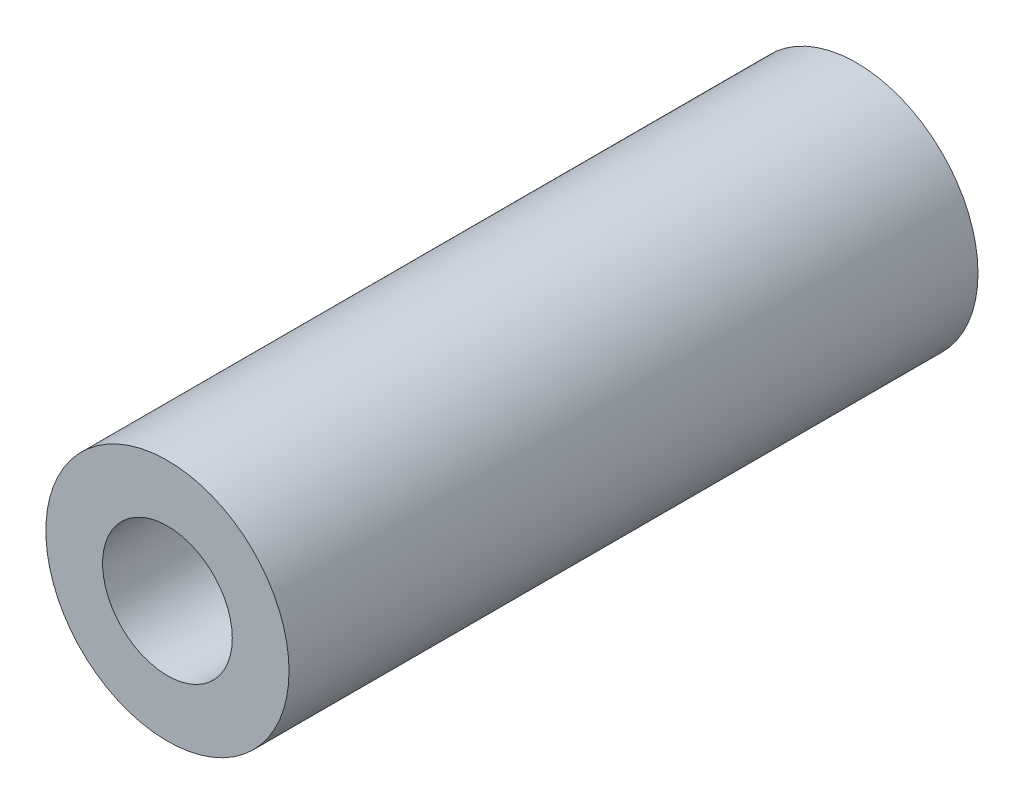
from build123d import *

# Parameters (mm, degrees)
SKETCH1_R      = 3
SKETCH1_R_2    = 1.6
EXTRUDE1_DEPTH = 8.5


with BuildPart() as part:
    # Sketch1 → Extrude1 (new, symmetric)
    with BuildSketch(Plane.XY):
        Circle(SKETCH1_R)
        Circle(SKETCH1_R_2, mode=Mode.SUBTRACT)
    extrude(amount=EXTRUDE1_DEPTH, both=True)


solid = part.part
